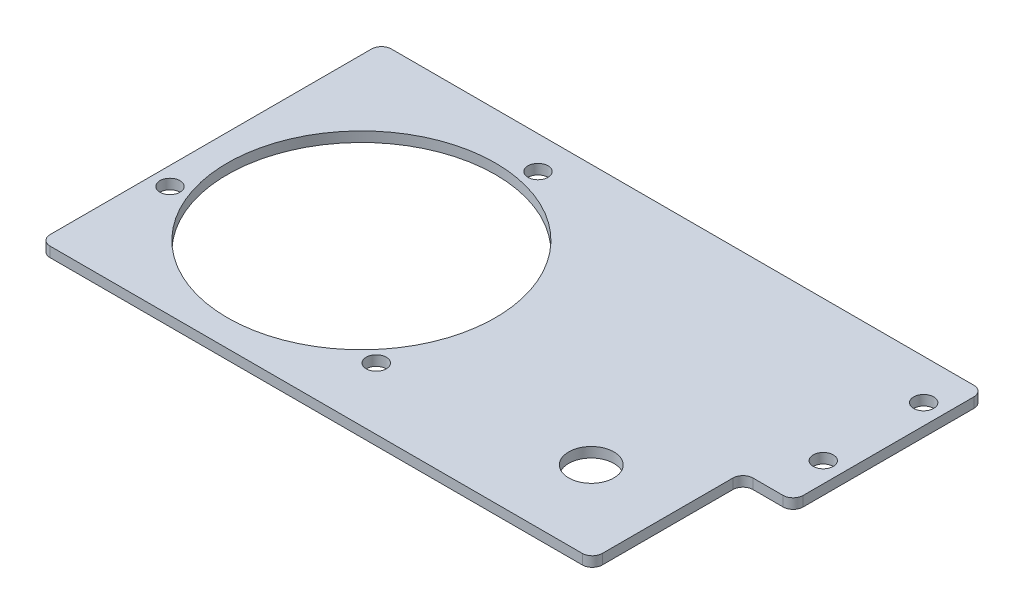
from build123d import *

# Parameters (mm, degrees)
SKETCH1_R           = 84.7725
SKETCH1_R_2         = 6.35
BOSS_EXTRUDE1_DEPTH = 6.35
SKETCH4_R           = 14.2875
CUT_EXTRUDE1_DEPTH  = 9.652


with BuildPart() as part:
    # Sketch1 → Boss-Extrude1 (new body)
    with BuildSketch(Plane(origin=(0, 0, 0), x_dir=(1, 0, 0), z_dir=(0, 1, 0))):
        with BuildLine():
            Line((273.05, 114.3), (-95.25, 114.3))
            ThreePointArc((-95.25, 114.3), (-99.740128061, 112.440128061), (-101.6, 107.95))
            Line((-101.6, 107.95), (-101.6, -95.25))
            ThreePointArc((-101.6, -95.25), (-99.740128061, -99.740128061), (-95.25, -101.6))
            Line((-95.25, -101.6), (241.3, -101.6))
            ThreePointArc((241.3, -101.6), (245.790128061, -99.740128061), (247.65, -95.25))
            Line((247.65, -95.25), (247.65, -12.7))
            ThreePointArc((247.65, -12.7), (249.509871939, -8.209871939), (254, -6.35))
            Line((254, -6.35), (273.05, -6.35))
            ThreePointArc((273.05, -6.35), (277.540128061, -4.490128061), (279.4, 0))
            Line((279.4, 0), (279.4, 107.95))
            ThreePointArc((279.4, 107.95), (277.540128061, 112.440128061), (273.05, 114.3))
        make_face()
        with Locations(Location((0, 0, 0), (0, 0, 270))):
            Circle(SKETCH1_R, mode=Mode.SUBTRACT)
        with Locations(Location((-90.060644326, -31.010366712, 0), (0, 0, 270))):
            Circle(SKETCH1_R_2, mode=Mode.SUBTRACT)
        with Locations(Location((18.17455681, 93.499989223, 0), (0, 0, 270))):
            Circle(SKETCH1_R_2, mode=Mode.SUBTRACT)
        with Locations(Location((71.886087516, -62.489622511, 0), (0, 0, 270))):
            Circle(SKETCH1_R_2, mode=Mode.SUBTRACT)
        with Locations(Location((266.7, 88.9, 0), (0, 0, 270))):
            Circle(SKETCH1_R_2, mode=Mode.SUBTRACT)
        with Locations(Location((266.7, 25.4, 0), (0, 0, 270))):
            Circle(SKETCH1_R_2, mode=Mode.SUBTRACT)
    extrude(amount=BOSS_EXTRUDE1_DEPTH)

    # Sketch4 → Cut-Extrude1 (cut)
    with BuildSketch(Plane(origin=(0, 6.35, 0), x_dir=(1, 0, 0), z_dir=(0, 1, 0))):
        with Locations(Location((195.68668, -50.292, 0), (0, 0, 270))):
            Circle(SKETCH4_R)
    extrude(amount=-CUT_EXTRUDE1_DEPTH, mode=Mode.SUBTRACT)


solid = part.part
